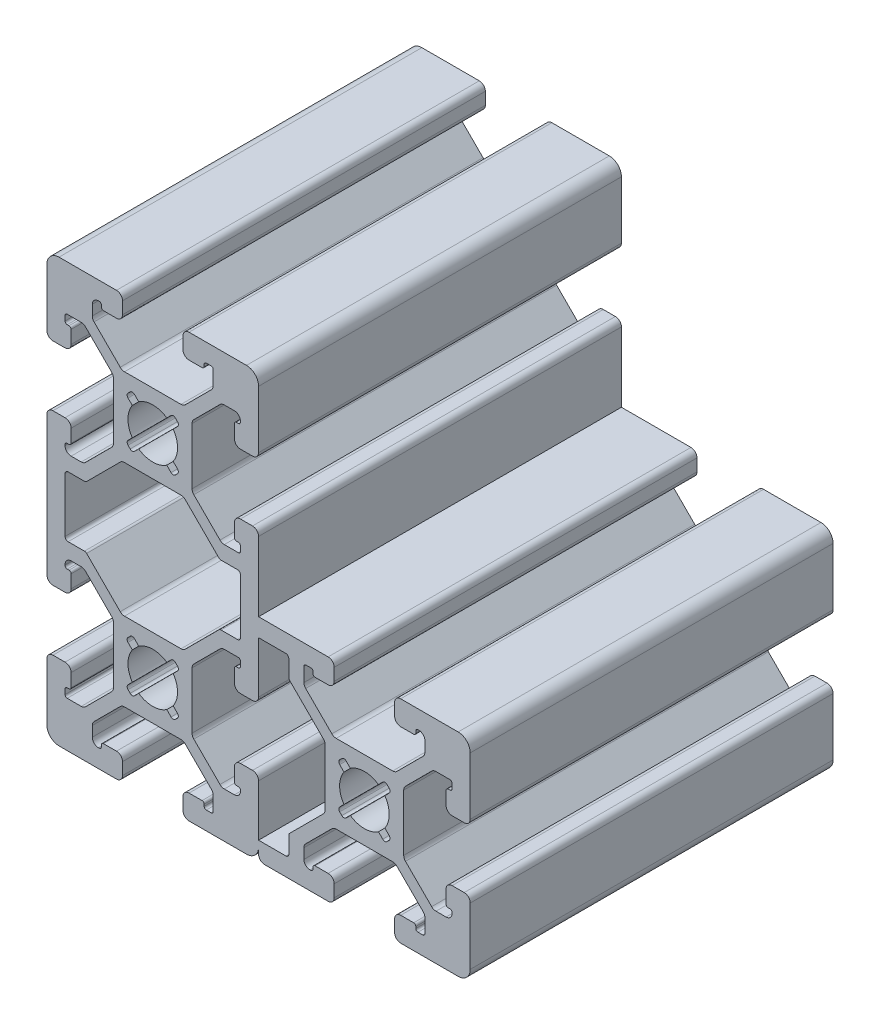
from build123d import *

# Parameters (mm, degrees)
Y_KSEKLIK_EKSTR_ZYON1_DEPTH = 60
G_VDE_TA_KOPYALA1_ANGLE     = 90
FILLET1_R                   = 1


with BuildPart() as part:
    # Çizim3 → Yükseklik-Ekstrüzyon1 (new body)
    with BuildSketch(Plane.XY):
        with BuildLine():
            Line((-12.5, 34), (-12.5, 32))
            ThreePointArc((-12.5, 32), (-12.207106781, 31.292893219), (-11.5, 31))
            Line((-11.5, 31), (-9.35, 31))
            ThreePointArc((-9.35, 31), (-9.102512627, 31.102512627), (-9, 31.35))
            Line((-9, 31.35), (-9, 31.65))
            ThreePointArc((-9, 31.65), (-8.897487373, 31.897487373), (-8.65, 32))
            Line((-8.65, 32), (-7.85, 32))
            ThreePointArc((-7.85, 32), (-7.602512627, 31.897487373), (-7.5, 31.65))
            Line((-7.5, 31.65), (-7.5, 29.328427125))
            ThreePointArc((-7.5, 29.328427125), (-7.576120467, 28.945743692), (-7.792893219, 28.621320344))
            Line((-7.792893219, 28.621320344), (-12.121320344, 24.292893219))
            ThreePointArc((-12.121320344, 24.292893219), (-12.445743692, 24.076120467), (-12.828427125, 24))
            Line((-12.828427125, 24), (-17.5, 24))
            Line((-17.5, 24), (-22.171572875, 24))
            ThreePointArc((-22.171572875, 24), (-22.554256308, 24.076120467), (-22.878679656, 24.292893219))
            Line((-22.878679656, 24.292893219), (-27.207106781, 28.621320344))
            ThreePointArc((-27.207106781, 28.621320344), (-27.423879533, 28.945743692), (-27.5, 29.328427125))
            Line((-27.5, 29.328427125), (-27.5, 31))
            ThreePointArc((-27.5, 31), (-27.207106781, 31.707106781), (-26.5, 32))
            Line((-26.5, 32), (-26.35, 32))
            ThreePointArc((-26.35, 32), (-26.102512627, 31.897487373), (-26, 31.65))
            Line((-26, 31.65), (-26, 31.35))
            ThreePointArc((-26, 31.35), (-25.897487373, 31.102512627), (-25.65, 31))
            Line((-25.65, 31), (-23.5, 31))
            ThreePointArc((-23.5, 31), (-22.792893219, 31.292893219), (-22.5, 32))
            Line((-22.5, 32), (-22.5, 34))
            ThreePointArc((-22.5, 34), (-22.792893219, 34.707106781), (-23.5, 35))
            Line((-23.5, 35), (-33, 35))
            ThreePointArc((-33, 35), (-34.414213562, 34.414213562), (-35, 33))
            Line((-35, 33), (-35, 23.5))
            ThreePointArc((-35, 23.5), (-34.707106781, 22.792893219), (-34, 22.5))
            Line((-34, 22.5), (-32, 22.5))
            ThreePointArc((-32, 22.5), (-31.292893219, 22.792893219), (-31, 23.5))
            Line((-31, 23.5), (-31, 25.65))
            ThreePointArc((-31, 25.65), (-31.102512627, 25.897487373), (-31.35, 26))
            Line((-31.35, 26), (-31.65, 26))
            ThreePointArc((-31.65, 26), (-31.897487373, 26.102512627), (-32, 26.35))
            Line((-32, 26.35), (-32, 27.15))
            ThreePointArc((-32, 27.15), (-31.897487373, 27.397487373), (-31.65, 27.5))
            Line((-31.65, 27.5), (-29.328427125, 27.5))
            ThreePointArc((-29.328427125, 27.5), (-28.945743692, 27.423879533), (-28.621320344, 27.207106781))
            Line((-28.621320344, 27.207106781), (-24.292893219, 22.878679656))
            ThreePointArc((-24.292893219, 22.878679656), (-24.076120467, 22.554256308), (-24, 22.171572875))
            Line((-24, 22.171572875), (-24, 17.5))
            Line((-24, 17.5), (-24, 12.828427125))
            ThreePointArc((-24, 12.828427125), (-24.076120467, 12.445743692), (-24.292893219, 12.121320344))
            Line((-24.292893219, 12.121320344), (-28.621320344, 7.792893219))
            ThreePointArc((-28.621320344, 7.792893219), (-28.945743692, 7.576120467), (-29.328427125, 7.5))
            Line((-29.328427125, 7.5), (-31, 7.5))
            ThreePointArc((-31, 7.5), (-31.707106781, 7.792893219), (-32, 8.5))
            Line((-32, 8.5), (-32, 8.65))
            ThreePointArc((-32, 8.65), (-31.897487373, 8.897487373), (-31.65, 9))
            Line((-31.65, 9), (-31.35, 9))
            ThreePointArc((-31.35, 9), (-31.102512627, 9.102512627), (-31, 9.35))
            Line((-31, 9.35), (-31, 11.5))
            ThreePointArc((-31, 11.5), (-31.292893219, 12.207106781), (-32, 12.5))
            Line((-32, 12.5), (-34, 12.5))
            ThreePointArc((-34, 12.5), (-34.707106781, 12.207106781), (-35, 11.5))
            Line((-35, 11.5), (-35, 0))
            Line((-35, 0), (-32, 0))
            Line((-32, 0), (-32, 4.5))
            ThreePointArc((-32, 4.5), (-31.853553391, 4.853553391), (-31.5, 5))
            Line((-31.5, 5), (-28.792893219, 5))
            ThreePointArc((-28.792893219, 5), (-28.601551503, 5.038060234), (-28.439339828, 5.146446609))
            Line((-28.439339828, 5.146446609), (-22.878679656, 10.707106781))
            ThreePointArc((-22.878679656, 10.707106781), (-22.554256308, 10.923879533), (-22.171572875, 11))
            Line((-22.171572875, 11), (-17.5, 11))
            Line((-17.5, 11), (-12.828427125, 11))
            ThreePointArc((-12.828427125, 11), (-12.445743692, 10.923879533), (-12.121320344, 10.707106781))
            Line((-12.121320344, 10.707106781), (-6.560660172, 5.146446609))
            ThreePointArc((-6.560660172, 5.146446609), (-6.398448497, 5.038060234), (-6.207106781, 5))
            Line((-6.207106781, 5), (-3.5, 5))
            ThreePointArc((-3.5, 5), (-3.146446609, 4.853553391), (-3, 4.5))
            Line((-3, 4.5), (-3, 0))
            Line((-3, 0), (0, 0))
            Line((0, 0), (0, 11.5))
            ThreePointArc((0, 11.5), (-0.292893219, 12.207106781), (-1, 12.5))
            Line((-1, 12.5), (-3, 12.5))
            ThreePointArc((-3, 12.5), (-3.707106781, 12.207106781), (-4, 11.5))
            Line((-4, 11.5), (-4, 9.35))
            ThreePointArc((-4, 9.35), (-3.897487373, 9.102512627), (-3.65, 9))
            Line((-3.65, 9), (-3.35, 9))
            ThreePointArc((-3.35, 9), (-3.102512627, 8.897487373), (-3, 8.65))
            Line((-3, 8.65), (-3, 7.85))
            ThreePointArc((-3, 7.85), (-3.102512627, 7.602512627), (-3.35, 7.5))
            Line((-3.35, 7.5), (-5.671572875, 7.5))
            ThreePointArc((-5.671572875, 7.5), (-6.054256308, 7.576120467), (-6.378679656, 7.792893219))
            Line((-6.378679656, 7.792893219), (-10.707106781, 12.121320344))
            ThreePointArc((-10.707106781, 12.121320344), (-10.923879533, 12.445743692), (-11, 12.828427125))
            Line((-11, 12.828427125), (-11, 17.5))
            Line((-11, 17.5), (-11, 22.171572875))
            ThreePointArc((-11, 22.171572875), (-10.923879533, 22.554256308), (-10.707106781, 22.878679656))
            Line((-10.707106781, 22.878679656), (-6.378679656, 27.207106781))
            ThreePointArc((-6.378679656, 27.207106781), (-6.054256308, 27.423879533), (-5.671572875, 27.5))
            Line((-5.671572875, 27.5), (-4, 27.5))
            ThreePointArc((-4, 27.5), (-3.292893219, 27.207106781), (-3, 26.5))
            Line((-3, 26.5), (-3, 26.35))
            ThreePointArc((-3, 26.35), (-3.102512627, 26.102512627), (-3.35, 26))
            Line((-3.35, 26), (-3.65, 26))
            ThreePointArc((-3.65, 26), (-3.897487373, 25.897487373), (-4, 25.65))
            Line((-4, 25.65), (-4, 23.5))
            ThreePointArc((-4, 23.5), (-3.707106781, 22.792893219), (-3, 22.5))
            Line((-3, 22.5), (-1, 22.5))
            ThreePointArc((-1, 22.5), (-0.292893219, 22.792893219), (0, 23.5))
            Line((0, 23.5), (0, 33))
            ThreePointArc((0, 33), (-0.585786438, 34.414213562), (-2, 35))
            Line((-2, 35), (-11.5, 35))
            ThreePointArc((-11.5, 35), (-12.207106781, 34.707106781), (-12.5, 34))
        make_face()
        with BuildLine():
            Line((-15.180110796, 20.880549376), (-14.473004015, 21.587656157))
            ThreePointArc((-14.473004015, 21.587656157), (-14.119450624, 21.734102766), (-13.765897234, 21.587656157))
            Line((-13.765897234, 21.587656157), (-13.412343843, 21.234102766))
            ThreePointArc((-13.412343843, 21.234102766), (-13.265897234, 20.880549376), (-13.412343843, 20.526995985))
            Line((-13.412343843, 20.526995985), (-14.119450624, 19.819889204))
            ThreePointArc((-14.119450624, 19.819889204), (-13.4, 17.5), (-14.119450624, 15.180110796))
            Line((-14.119450624, 15.180110796), (-13.412343843, 14.473004015))
            ThreePointArc((-13.412343843, 14.473004015), (-13.265897234, 14.119450624), (-13.412343843, 13.765897234))
            Line((-13.412343843, 13.765897234), (-13.765897234, 13.412343843))
            ThreePointArc((-13.765897234, 13.412343843), (-14.119450624, 13.265897234), (-14.473004015, 13.412343843))
            Line((-14.473004015, 13.412343843), (-15.180110796, 14.119450624))
            ThreePointArc((-15.180110796, 14.119450624), (-17.5, 13.4), (-19.819889204, 14.119450624))
            Line((-19.819889204, 14.119450624), (-20.526995985, 13.412343843))
            ThreePointArc((-20.526995985, 13.412343843), (-20.880549376, 13.265897234), (-21.234102766, 13.412343843))
            Line((-21.234102766, 13.412343843), (-21.587656157, 13.765897234))
            ThreePointArc((-21.587656157, 13.765897234), (-21.734102766, 14.119450624), (-21.587656157, 14.473004015))
            Line((-21.587656157, 14.473004015), (-20.880549376, 15.180110796))
            ThreePointArc((-20.880549376, 15.180110796), (-21.6, 17.5), (-20.880549376, 19.819889204))
            Line((-20.880549376, 19.819889204), (-21.587656157, 20.526995985))
            ThreePointArc((-21.587656157, 20.526995985), (-21.734102766, 20.880549376), (-21.587656157, 21.234102766))
            Line((-21.587656157, 21.234102766), (-21.234102766, 21.587656157))
            ThreePointArc((-21.234102766, 21.587656157), (-20.880549376, 21.734102766), (-20.526995985, 21.587656157))
            Line((-20.526995985, 21.587656157), (-19.819889204, 20.880549376))
            ThreePointArc((-19.819889204, 20.880549376), (-17.5, 21.6), (-15.180110796, 20.880549376))
        make_face(mode=Mode.SUBTRACT)
    extrude(amount=-Y_KSEKLIK_EKSTR_ZYON1_DEPTH)


with BuildPart() as body_2:
    # Aynalama1: mirrored copy
    add(part.part.mirror(Plane(origin=(-35, 0, -60), x_dir=(0, 0, 1), z_dir=(0, -1, 0))))


with BuildPart() as body_3:
    # Gövde-Taşı/Kopyala1: copy of body 2
    add(body_2.part.rotate(Axis((0, 0, 0), (0, 0, 1)), G_VDE_TA_KOPYALA1_ANGLE))


with BuildPart() as body_2_1:
    add(body_2.part)

    # Combine1: union part, body 3
    add(part.part)
    add(body_3.part)

    # Fillet1
    fillet1_edges = [body_2_1.edges().sort_by_distance(p)[0] for p in [
        (0, -35, -30),
    ]]
    fillet(fillet1_edges, radius=FILLET1_R)


solid = body_2_1.part
